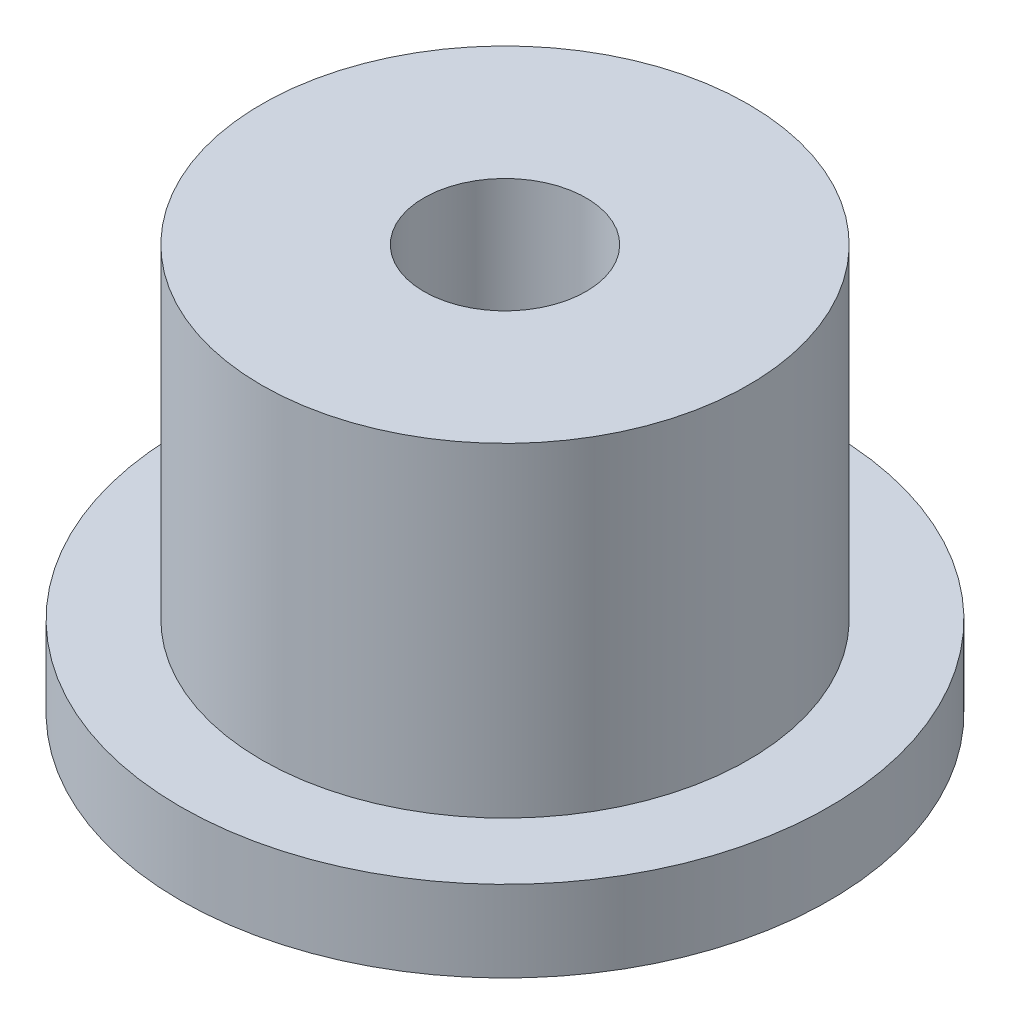
from build123d import *

# Parameters (mm, degrees)
SKETCH1_R           = 100
SKETCH1_R_2         = 75
BOSS_EXTRUDE1_DEPTH = 25
SKETCH1_3_R         = 75
SKETCH1_3_R_2       = 25
BOSS_EXTRUDE2_DEPTH = 125


with BuildPart() as part:
    # Sketch1 → Boss-Extrude1 (new body)
    with BuildSketch(Plane(origin=(0, 0, 0), x_dir=(1, 0, 0), z_dir=(0, 1, 0))):
        Circle(SKETCH1_R)
        Circle(SKETCH1_R_2, mode=Mode.SUBTRACT)
    extrude(amount=BOSS_EXTRUDE1_DEPTH)

    # Sketch1<3> → Boss-Extrude2 (add)
    with BuildSketch(Plane(origin=(0, 0, 0), x_dir=(1, 0, 0), z_dir=(0, 1, 0))):
        Circle(SKETCH1_3_R)
        Circle(SKETCH1_3_R_2, mode=Mode.SUBTRACT)
    extrude(amount=BOSS_EXTRUDE2_DEPTH)


solid = part.part
